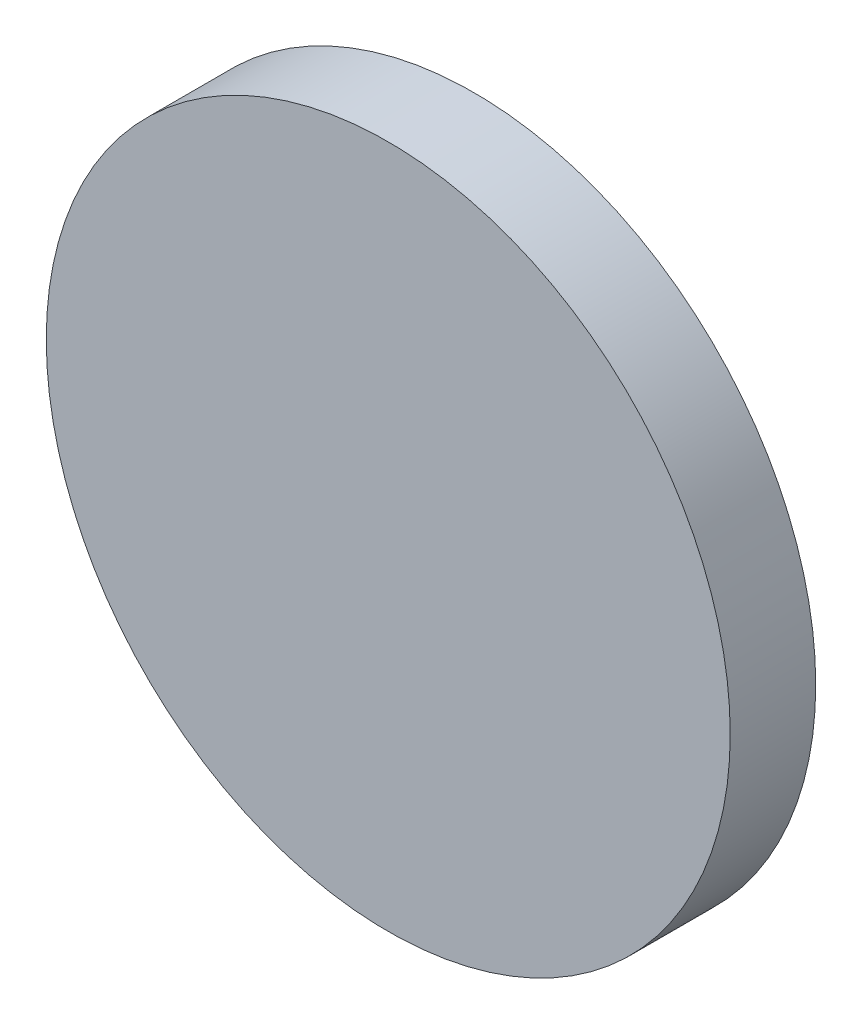
from build123d import *

# Parameters (mm, degrees)
ESQUISSE1_R        = 25.4
BOSS_EXTRU_1_DEPTH = 6.35


with BuildPart() as part:
    # Esquisse1 → Boss.-Extru.1 (new body)
    with BuildSketch(Plane.XY):
        Circle(ESQUISSE1_R)
    extrude(amount=BOSS_EXTRU_1_DEPTH)


solid = part.part
